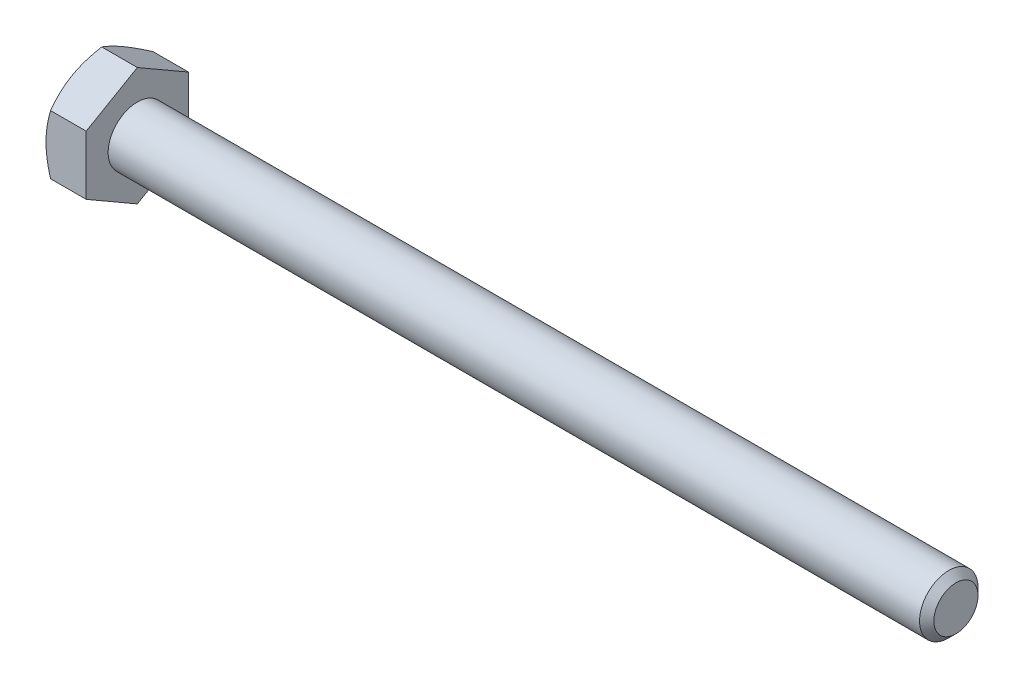
from build123d import *

# Parameters (mm, degrees)
SKETCH5_R           = 3.175
BOSS_EXTRUDE3_DEPTH = 88.9
CHAMFER1_SIZE       = 0.77724
BOSS_EXTRUDE4_DEPTH = 4.365625
SKETCH8_OUTSIDE_W   = 359.952
SKETCH8_OUTSIDE_H   = 361.672
SKETCH8_OUTSIDE_R   = 5.55625
CUT_EXTRUDE3_DEPTH  = 94.651007858
CUT_EXTRUDE3_DRAFT  = -60
CUT_EXTRUDE4_DEPTH  = 0.254
CIRPATTERN1_COUNT   = 3


with BuildPart() as part:
    # Sketch5 → Boss-Extrude3 (new body)
    with BuildSketch(Plane(origin=(46.6328125, 0, 0), x_dir=(0, 0, -1), z_dir=(1, 0, 0))):
        Circle(SKETCH5_R)
    extrude(amount=-BOSS_EXTRUDE3_DEPTH)

    # Chamfer1
    chamfer1_edges = [part.edges().sort_by_distance(p)[0] for p in [
        (46.6328125, 0, 3.175),
    ]]
    chamfer(chamfer1_edges, length=CHAMFER1_SIZE)

    # Sketch6 → Boss-Extrude4 (add)
    with BuildSketch(Plane.ZY.offset(42.2671875)):
        Polygon((5.55625, 3.207902433), (0, 6.415804866), (-5.55625, 3.207902433), (-5.55625, -3.207902433), (0, -6.415804866), (5.55625, -3.207902433), align=None)
    extrude(amount=BOSS_EXTRUDE4_DEPTH)


with BuildPart() as cut_extrude3_tool:
    # Sketch8 outside → Cut-Extrude3 (with draft: the straight prism first)
    with BuildSketch(Plane.ZY.offset(46.6328125)):
        Rectangle(SKETCH8_OUTSIDE_W, SKETCH8_OUTSIDE_H)
        Circle(SKETCH8_OUTSIDE_R, mode=Mode.SUBTRACT)
    extrude(amount=-CUT_EXTRUDE3_DEPTH)
    # Cut-Extrude3: the draft: its side faces are tilted about the plane it starts from
    cut_extrude3_sides = [cut_extrude3_tool.faces().sort_by_distance(p)[0] for p in [
        (0.692691429, -180.836, 0),
        (0.692691429, 0, 179.976),
        (0.692691429, 180.836, 0),
        (0.692691429, 0, -179.976),
        (0.692691429, 0, -5.55625),
    ]]
    draft(cut_extrude3_sides, Plane.ZY.offset(46.6328125), CUT_EXTRUDE3_DRAFT)


with BuildPart() as part_1:
    add(part.part)

    # Cut-Extrude3: cut by cut_extrude3_tool
    add(cut_extrude3_tool.part, mode=Mode.SUBTRACT)

    # Sketch12 → Cut-Extrude4 (cut)
    with BuildSketch(Plane.ZY.offset(46.6328125)):
        with BuildLine():
            Line((0.1666875, 4.2783125), (0.1666875, 2.3891875))
            ThreePointArc((0.1666875, 2.3891875), (0, 2.2225), (-0.1666875, 2.3891875))
            Line((-0.1666875, 2.3891875), (-0.1666875, 4.2783125))
            ThreePointArc((-0.1666875, 4.2783125), (0, 4.445), (0.1666875, 4.2783125))
        make_face()
    cut_extrude4 = extrude(amount=-CUT_EXTRUDE4_DEPTH, mode=Mode.SUBTRACT)

    # CirPattern1: Cut-Extrude4 ×3 about axis
    cirpattern1_axis = Axis((0, 0, 0), (1, 0, 0))
    for i in range(1, CIRPATTERN1_COUNT):
        add(cut_extrude4.rotate(cirpattern1_axis, i * 360 / CIRPATTERN1_COUNT), mode=Mode.SUBTRACT)


solid = part_1.part
